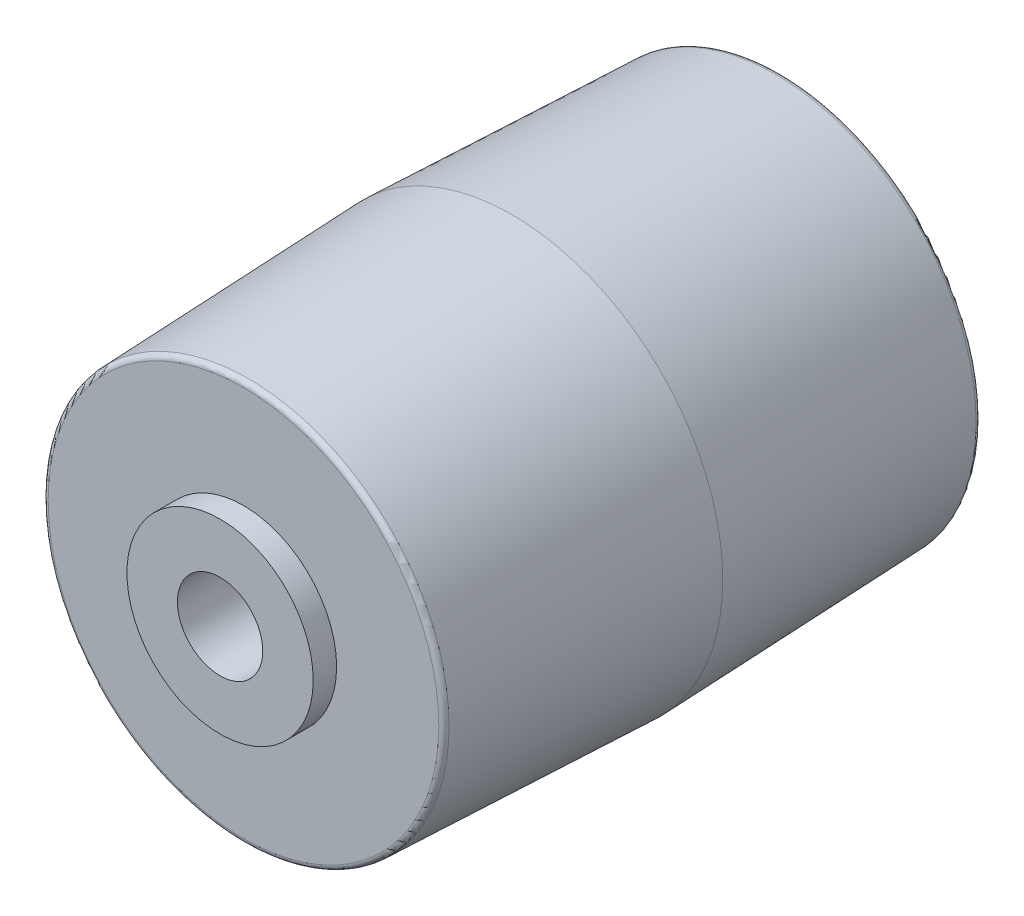
from build123d import *

# Parameters (mm, degrees)
SKETCH2_R          = 1.0414
CUT_EXTRUDE1_DEPTH = 16.998643219
FILLET1_R          = 0.127


with BuildPart() as part:
    # Sketch1 → Revolve1 (revolve)
    with BuildSketch(Plane(origin=(0, 0, 0), x_dir=(0, 0, -1), z_dir=(1, 0, 0)), mode=Mode.PRIVATE) as revolve1_sk:
        Polygon((-7.1247, 0), (-7.1247, 2.2733), (-6.5532, 2.2733), (-6.5532, 4.8895), (0, 5.1435), (6.5532, 4.8895), (6.5532, 2.2733), (7.1247, 2.2733), (7.1247, 0), align=None)
    revolve(revolve1_sk.sketch.rotate(Axis((0, 0, 7.1247), (0, 0, -1)), 90), axis=Axis((0, 0, 7.1247), (0, 0, -1)))

    # Sketch2 → Cut-Extrude1 (cut, through all)
    with BuildSketch(Plane.XY.offset(7.1247)):
        Circle(SKETCH2_R)
    extrude(amount=-CUT_EXTRUDE1_DEPTH, mode=Mode.SUBTRACT)

    # Fillet1
    fillet1_edges = [part.edges().sort_by_distance(p)[0] for p in [
        (-4.8895, 0, 6.5532),
        (-4.8895, 0, -6.5532),
    ]]
    fillet(fillet1_edges, radius=FILLET1_R)


solid = part.part
